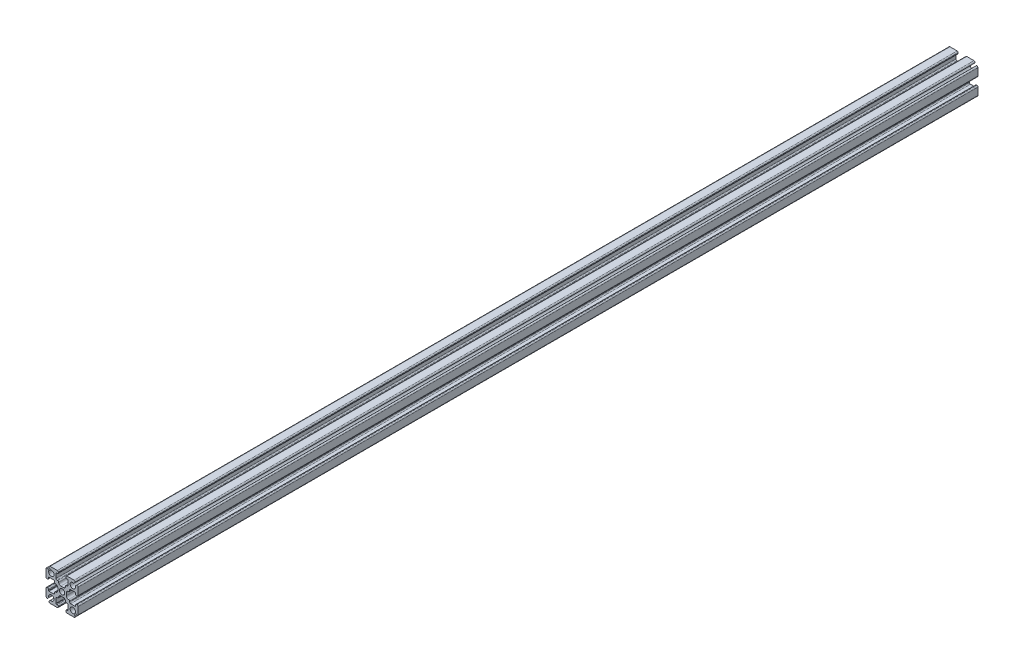
from build123d import *

# Parameters (mm, degrees)
SKETCH1_R           = 1.25
BOSS_EXTRUDE1_DEPTH = 420


with BuildPart() as part:
    # Sketch1 → Boss-Extrude1 (new body)
    with BuildSketch(Plane(origin=(0, 0, 0), x_dir=(-1, 0, 0), z_dir=(0, 0, -1))):
        with BuildLine():
            Line((6.646446609, 5.939339828), (6.163645978, 5.456539197))
            ThreePointArc((6.163645978, 5.456539197), (4.116116524, 4.116116524), (5.456539197, 6.163645978))
            Line((5.456539197, 6.163645978), (5.939339828, 6.646446609))
            ThreePointArc((5.939339828, 6.646446609), (6.047726204, 7.191341716), (5.585786438, 7.5))
            Line((5.585786438, 7.5), (2.25, 7.5))
            ThreePointArc((2.25, 7.5), (1.896446609, 7.353553391), (1.75, 7))
            Line((1.75, 7), (1.75, 6.8))
            ThreePointArc((1.75, 6.8), (1.896446609, 6.446446609), (2.25, 6.3))
            Line((2.25, 6.3), (2.65, 6.3))
            ThreePointArc((2.65, 6.3), (2.791421356, 6.241421356), (2.85, 6.1))
            Line((2.85, 6.1), (2.85, 4))
            ThreePointArc((2.85, 4), (2.703553391, 3.646446609), (2.35, 3.5))
            Line((2.35, 3.5), (2.1, 3.5))
            ThreePointArc((2.1, 3.5), (1.746446609, 3.353553391), (1.6, 3))
            ThreePointArc((1.6, 3), (1.307106781, 2.292893219), (0.6, 2))
            Line((0.6, 2), (-0.6, 2))
            ThreePointArc((-0.6, 2), (-1.307106781, 2.292893219), (-1.6, 3))
            ThreePointArc((-1.6, 3), (-1.746446609, 3.353553391), (-2.1, 3.5))
            Line((-2.1, 3.5), (-2.35, 3.5))
            ThreePointArc((-2.35, 3.5), (-2.703553391, 3.646446609), (-2.85, 4))
            Line((-2.85, 4), (-2.85, 6.1))
            ThreePointArc((-2.85, 6.1), (-2.791421356, 6.241421356), (-2.65, 6.3))
            Line((-2.65, 6.3), (-2.25, 6.3))
            ThreePointArc((-2.25, 6.3), (-1.896446609, 6.446446609), (-1.75, 6.8))
            Line((-1.75, 6.8), (-1.75, 7))
            ThreePointArc((-1.75, 7), (-1.896446609, 7.353553391), (-2.25, 7.5))
            Line((-2.25, 7.5), (-5.585786438, 7.5))
            ThreePointArc((-5.585786438, 7.5), (-6.047726204, 7.191341716), (-5.939339828, 6.646446609))
            Line((-5.939339828, 6.646446609), (-5.456539197, 6.163645978))
            ThreePointArc((-5.456539197, 6.163645978), (-4.116116524, 4.116116524), (-6.163645978, 5.456539197))
            Line((-6.163645978, 5.456539197), (-6.646446609, 5.939339828))
            ThreePointArc((-6.646446609, 5.939339828), (-7.191341716, 6.047726204), (-7.5, 5.585786438))
            Line((-7.5, 5.585786438), (-7.5, 2.25))
            ThreePointArc((-7.5, 2.25), (-7.353553391, 1.896446609), (-7, 1.75))
            Line((-7, 1.75), (-6.8, 1.75))
            ThreePointArc((-6.8, 1.75), (-6.446446609, 1.896446609), (-6.3, 2.25))
            Line((-6.3, 2.25), (-6.3, 2.65))
            ThreePointArc((-6.3, 2.65), (-6.241421356, 2.791421356), (-6.1, 2.85))
            Line((-6.1, 2.85), (-4, 2.85))
            ThreePointArc((-4, 2.85), (-3.646446609, 2.703553391), (-3.5, 2.35))
            Line((-3.5, 2.35), (-3.5, 2.1))
            ThreePointArc((-3.5, 2.1), (-3.353553391, 1.746446609), (-3, 1.6))
            ThreePointArc((-3, 1.6), (-2.292893219, 1.307106781), (-2, 0.6))
            Line((-2, 0.6), (-2, -0.6))
            ThreePointArc((-2, -0.6), (-2.292893219, -1.307106781), (-3, -1.6))
            ThreePointArc((-3, -1.6), (-3.353553391, -1.746446609), (-3.5, -2.1))
            Line((-3.5, -2.1), (-3.5, -2.35))
            ThreePointArc((-3.5, -2.35), (-3.646446609, -2.703553391), (-4, -2.85))
            Line((-4, -2.85), (-6.1, -2.85))
            ThreePointArc((-6.1, -2.85), (-6.241421356, -2.791421356), (-6.3, -2.65))
            Line((-6.3, -2.65), (-6.3, -2.25))
            ThreePointArc((-6.3, -2.25), (-6.446446609, -1.896446609), (-6.8, -1.75))
            Line((-6.8, -1.75), (-7, -1.75))
            ThreePointArc((-7, -1.75), (-7.353553391, -1.896446609), (-7.5, -2.25))
            Line((-7.5, -2.25), (-7.5, -5.585786438))
            ThreePointArc((-7.5, -5.585786438), (-7.191341716, -6.047726204), (-6.646446609, -5.939339828))
            Line((-6.646446609, -5.939339828), (-6.163645978, -5.456539197))
            ThreePointArc((-6.163645978, -5.456539197), (-4.116116524, -4.116116524), (-5.456539197, -6.163645978))
            Line((-5.456539197, -6.163645978), (-5.939339828, -6.646446609))
            ThreePointArc((-5.939339828, -6.646446609), (-6.047726204, -7.191341716), (-5.585786438, -7.5))
            Line((-5.585786438, -7.5), (-2.25, -7.5))
            ThreePointArc((-2.25, -7.5), (-1.896446609, -7.353553391), (-1.75, -7))
            Line((-1.75, -7), (-1.75, -6.8))
            ThreePointArc((-1.75, -6.8), (-1.896446609, -6.446446609), (-2.25, -6.3))
            Line((-2.25, -6.3), (-2.65, -6.3))
            ThreePointArc((-2.65, -6.3), (-2.791421356, -6.241421356), (-2.85, -6.1))
            Line((-2.85, -6.1), (-2.85, -4))
            ThreePointArc((-2.85, -4), (-2.703553391, -3.646446609), (-2.35, -3.5))
            Line((-2.35, -3.5), (-2.1, -3.5))
            ThreePointArc((-2.1, -3.5), (-1.746446609, -3.353553391), (-1.6, -3))
            ThreePointArc((-1.6, -3), (-1.307106781, -2.292893219), (-0.6, -2))
            Line((-0.6, -2), (0.6, -2))
            ThreePointArc((0.6, -2), (1.307106781, -2.292893219), (1.6, -3))
            ThreePointArc((1.6, -3), (1.746446609, -3.353553391), (2.1, -3.5))
            Line((2.1, -3.5), (2.35, -3.5))
            ThreePointArc((2.35, -3.5), (2.703553391, -3.646446609), (2.85, -4))
            Line((2.85, -4), (2.85, -6.1))
            ThreePointArc((2.85, -6.1), (2.791421356, -6.241421356), (2.65, -6.3))
            Line((2.65, -6.3), (2.25, -6.3))
            ThreePointArc((2.25, -6.3), (1.896446609, -6.446446609), (1.75, -6.8))
            Line((1.75, -6.8), (1.75, -7))
            ThreePointArc((1.75, -7), (1.896446609, -7.353553391), (2.25, -7.5))
            Line((2.25, -7.5), (5.585786438, -7.5))
            ThreePointArc((5.585786438, -7.5), (6.047726204, -7.191341716), (5.939339828, -6.646446609))
            Line((5.939339828, -6.646446609), (5.456539197, -6.163645978))
            ThreePointArc((5.456539197, -6.163645978), (4.116116524, -4.116116524), (6.163645978, -5.456539197))
            Line((6.163645978, -5.456539197), (6.646446609, -5.939339828))
            ThreePointArc((6.646446609, -5.939339828), (7.191341716, -6.047726204), (7.5, -5.585786438))
            Line((7.5, -5.585786438), (7.5, -2.25))
            ThreePointArc((7.5, -2.25), (7.353553391, -1.896446609), (7, -1.75))
            Line((7, -1.75), (6.8, -1.75))
            ThreePointArc((6.8, -1.75), (6.446446609, -1.896446609), (6.3, -2.25))
            Line((6.3, -2.25), (6.3, -2.65))
            ThreePointArc((6.3, -2.65), (6.241421356, -2.791421356), (6.1, -2.85))
            Line((6.1, -2.85), (4, -2.85))
            ThreePointArc((4, -2.85), (3.646446609, -2.703553391), (3.5, -2.35))
            Line((3.5, -2.35), (3.5, -2.1))
            ThreePointArc((3.5, -2.1), (3.353553391, -1.746446609), (3, -1.6))
            ThreePointArc((3, -1.6), (2.292893219, -1.307106781), (2, -0.6))
            Line((2, -0.6), (2, 0.6))
            ThreePointArc((2, 0.6), (2.292893219, 1.307106781), (3, 1.6))
            ThreePointArc((3, 1.6), (3.353553391, 1.746446609), (3.5, 2.1))
            Line((3.5, 2.1), (3.5, 2.35))
            ThreePointArc((3.5, 2.35), (3.646446609, 2.703553391), (4, 2.85))
            Line((4, 2.85), (6.1, 2.85))
            ThreePointArc((6.1, 2.85), (6.241421356, 2.791421356), (6.3, 2.65))
            Line((6.3, 2.65), (6.3, 2.25))
            ThreePointArc((6.3, 2.25), (6.446446609, 1.896446609), (6.8, 1.75))
            Line((6.8, 1.75), (7, 1.75))
            ThreePointArc((7, 1.75), (7.353553391, 1.896446609), (7.5, 2.25))
            Line((7.5, 2.25), (7.5, 5.585786438))
            ThreePointArc((7.5, 5.585786438), (7.191341716, 6.047726204), (6.646446609, 5.939339828))
        make_face()
        with Locations(Location((0, 0, 0), (0, 0, 180))):
            Circle(SKETCH1_R, mode=Mode.SUBTRACT)
    extrude(amount=-BOSS_EXTRUDE1_DEPTH)


solid = part.part
